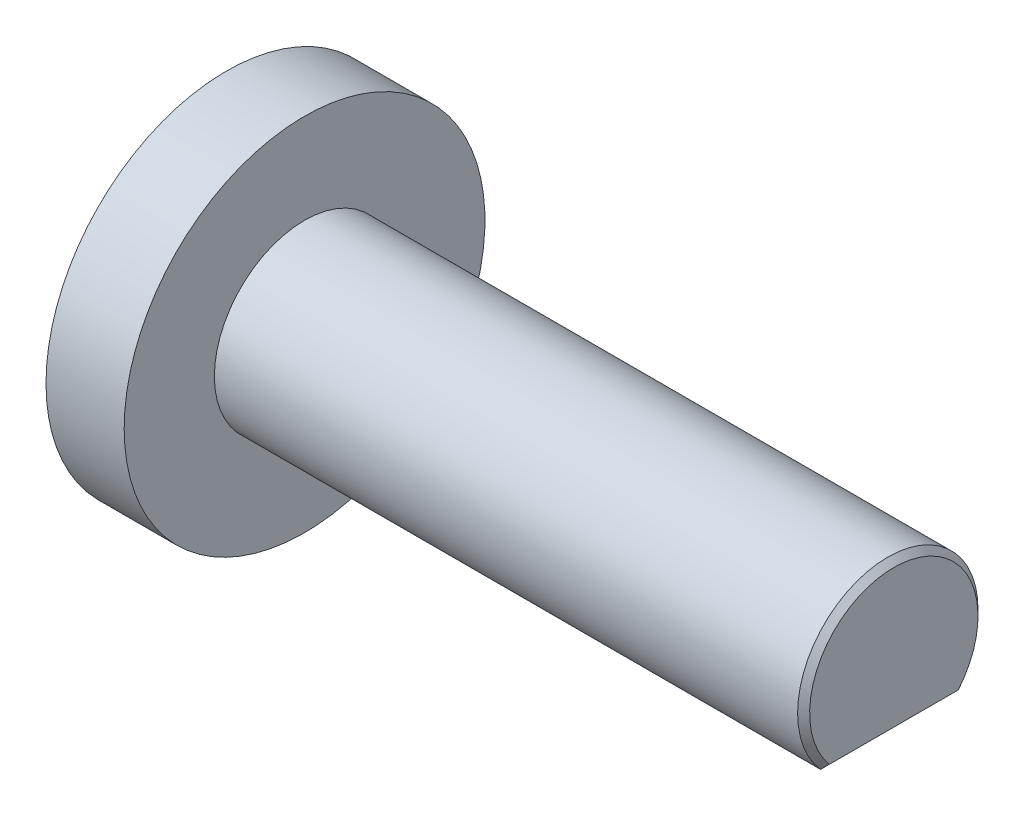
from build123d import *

# Parameters (mm, degrees)
SKIZZE2_W                       = 2.236067978
SKIZZE2_H                       = 0.5
SCHNITT_LINEAR_AUSTRAGEN1_DEPTH = 9
FASE1_SIZE                      = 0.1


with BuildPart() as part:
    # Skizze1 → Rotation1 (revolve)
    with BuildSketch(Plane.XY, mode=Mode.PRIVATE) as rotation1_sk:
        Polygon((0, 0), (0, 3), (1.3, 3), (1.3, 1.5), (11.1, 1.5), (11.1, 0), align=None)
    revolve(rotation1_sk.sketch.rotate(Axis((0, 0, 0), (1, 0, 0)), 90), axis=Axis((0, 0, 0), (1, 0, 0)))

    # Skizze2 → Schnitt-Linear austragen1 (cut)
    with BuildSketch(Plane(origin=(11.1, 0, 0), x_dir=(0, 0, -1), z_dir=(1, 0, 0))):
        with Locations((0, -1.25)):
            Rectangle(SKIZZE2_W, SKIZZE2_H)
    extrude(amount=-SCHNITT_LINEAR_AUSTRAGEN1_DEPTH, mode=Mode.SUBTRACT)

    # Fase1
    fase1_edges = [part.edges().sort_by_distance(p)[0] for p in [
        (11.1, 1.401258538, -0.535233135),
        (11.1, -1, 0),
    ]]
    chamfer(fase1_edges, length=FASE1_SIZE)


solid = part.part
